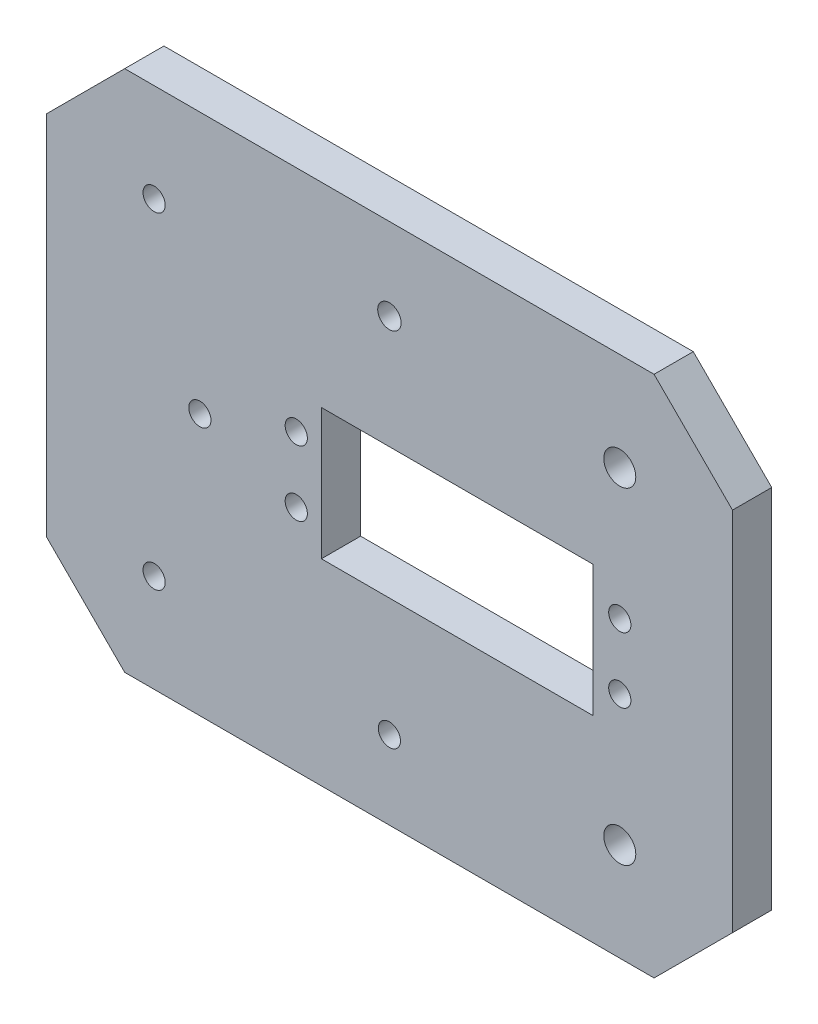
from build123d import *

# Parameters (mm, degrees)
SKETCH_1_R                = 1.7
SKETCH_1_R_2              = 2.45
SKETCH_1_R_3              = 1.786756839
SKETCH_1_W                = 41.55
SKETCH_1_H                = 20.05
F_02_PAN_SERVO_DECK_DEPTH = 6


with BuildPart() as part:
    # Эскиз1 → 02_Pan_servo_deck (new body)
    with BuildSketch(Plane.XY):
        Polygon((-40.5, -40), (40.5, -40), (52.5, -28), (52.5, 28), (40.5, 40), (-40.5, 40), (-52.5, 28), (-52.5, -28), align=None)
        with Locations((-14.25, -5)):
            Circle(SKETCH_1_R, mode=Mode.SUBTRACT)
        with Locations((-14.25, 5)):
            Circle(SKETCH_1_R, mode=Mode.SUBTRACT)
        with Locations((35.25, -5)):
            Circle(SKETCH_1_R, mode=Mode.SUBTRACT)
        with Locations((35.25, 5)):
            Circle(SKETCH_1_R, mode=Mode.SUBTRACT)
        with Locations((-36, -25)):
            Circle(SKETCH_1_R, mode=Mode.SUBTRACT)
        with Locations((-36, 25)):
            Circle(SKETCH_1_R, mode=Mode.SUBTRACT)
        with Locations((35.25, -25)):
            Circle(SKETCH_1_R_2, mode=Mode.SUBTRACT)
        with Locations((35.25, 25)):
            Circle(SKETCH_1_R_2, mode=Mode.SUBTRACT)
        with Locations((0, 27.45)):
            Circle(SKETCH_1_R_3, mode=Mode.SUBTRACT)
        with Locations((0, -28)):
            Circle(SKETCH_1_R, mode=Mode.SUBTRACT)
        with Locations((-29, 0)):
            Circle(SKETCH_1_R, mode=Mode.SUBTRACT)
        with Locations((10.375, 0.125)):
            Rectangle(SKETCH_1_W, SKETCH_1_H, mode=Mode.SUBTRACT)
    extrude(amount=F_02_PAN_SERVO_DECK_DEPTH)


solid = part.part
